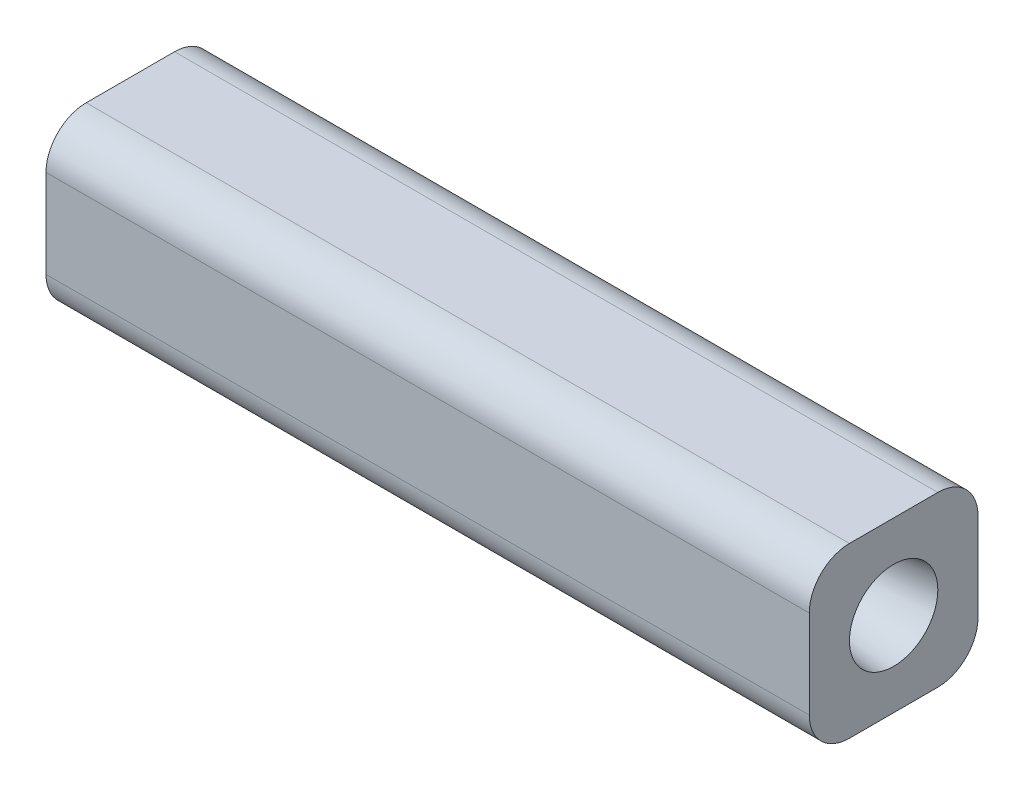
from build123d import *

# Parameters (mm, degrees)
BOSS_EXTRUDE1_DEPTH = 19
SKETCH1_3_R         = 1.1
CUT_EXTRUDE1_DEPTH  = 5
CUT_EXTRUDE1_TAPER  = 6


with BuildPart() as part:
    # Sketch1 → Boss-Extrude1 (new body)
    with BuildSketch(Plane.YZ):
        with BuildLine():
            Line((1, 0), (3.2, 0))
            ThreePointArc((3.2, 0), (3.907106781, 0.292893219), (4.2, 1))
            Line((4.2, 1), (4.2, 3.2))
            ThreePointArc((4.2, 3.2), (3.907106781, 3.907106781), (3.2, 4.2))
            Line((3.2, 4.2), (1, 4.2))
            ThreePointArc((1, 4.2), (0.292893219, 3.907106781), (0, 3.2))
            Line((0, 3.2), (0, 1))
            ThreePointArc((0, 1), (0.292893219, 0.292893219), (1, 0))
        make_face()
    extrude(amount=BOSS_EXTRUDE1_DEPTH)

    # Sketch1<3> → Cut-Extrude1 (cut)
    with BuildSketch(Plane.YZ):
        with Locations((2.1, 2.1)):
            Circle(SKETCH1_3_R)
    cut_extrude1 = extrude(amount=CUT_EXTRUDE1_DEPTH, taper=CUT_EXTRUDE1_TAPER, mode=Mode.SUBTRACT)

    # Mirror1: Cut-Extrude1 across plane
    add(cut_extrude1.mirror(Plane(origin=(9.5, 0, 0), x_dir=(0, 0, 1), z_dir=(1, 0, 0))), mode=Mode.SUBTRACT)


solid = part.part
